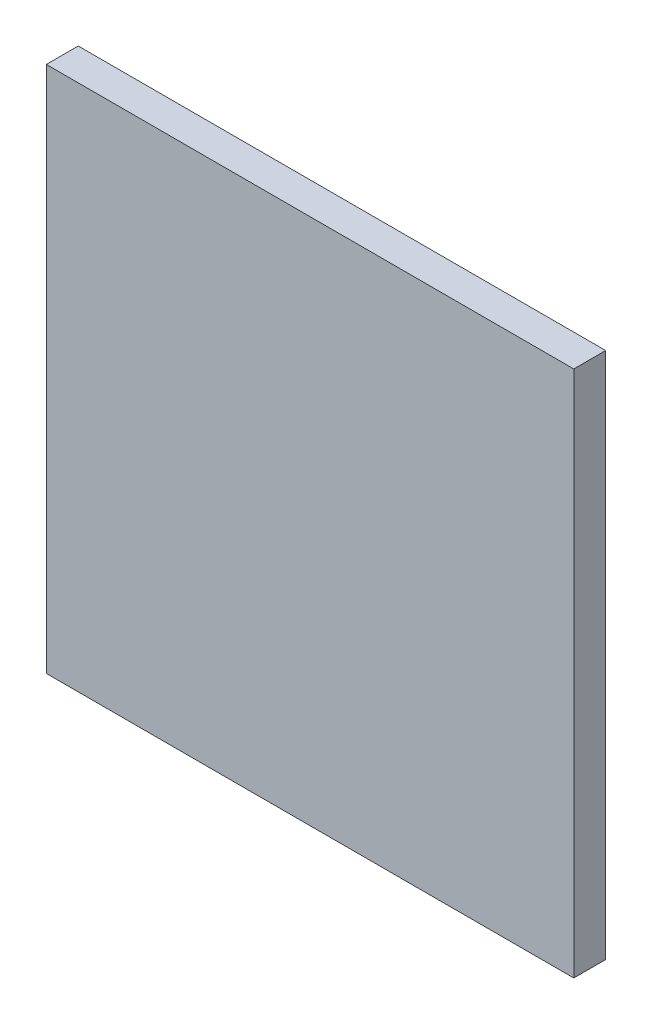
from build123d import *

# Parameters (mm, degrees)
SKETCH1_W  = 6.3
SKETCH1_H  = 6.3
CHIP_DEPTH = 0.381


with BuildPart() as part:
    # Sketch1 → chip (new body)
    with BuildSketch(Plane.XY):
        Rectangle(SKETCH1_W, SKETCH1_H)
    extrude(amount=CHIP_DEPTH)


solid = part.part
